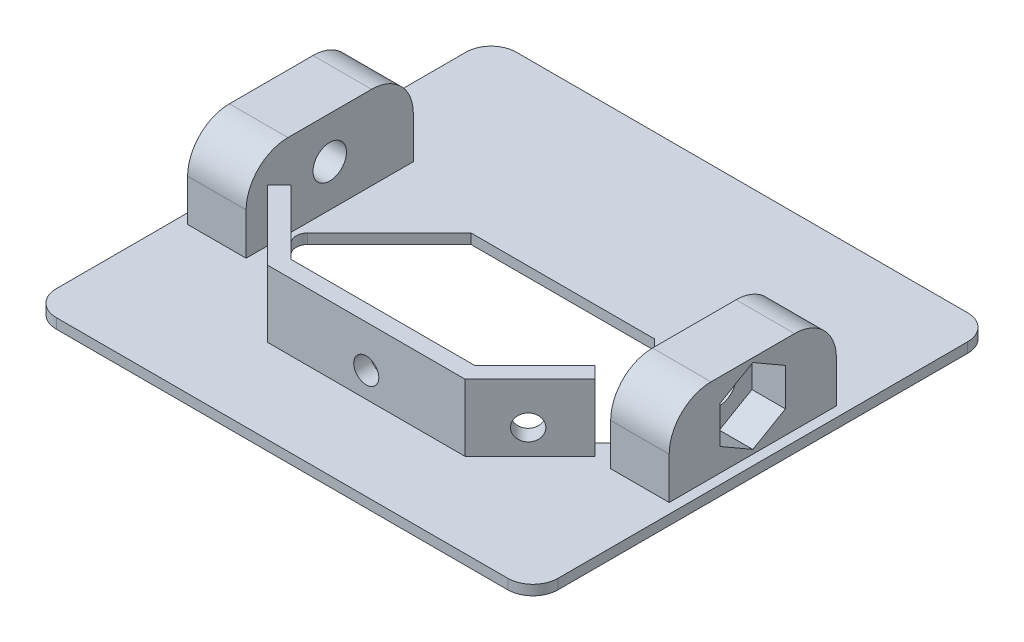
from build123d import *

# Parameters (mm, degrees)
ESBO_O1_W                = 60
ESBO_O1_H                = 55
RESSALTO_EXTRUS_O1_DEPTH = 1.2
ESBO_O2_W                = 22
ESBO_O2_H                = 21.5
CORTE_EXTRUS_O1_DEPTH    = 41.714739346
RESSALTO_EXTRUS_O2_DEPTH = 8
ESBO_O4_R                = 1.5
CORTE_EXTRUS_O2_DEPTH    = 7
ESBO_O5_R                = 1.5
CORTE_EXTRUS_O3_DEPTH    = 7
ESBO_O6_R                = 1.5
CORTE_EXTRUS_O4_DEPTH    = 7
FILETE1_R                = 3
FILETE2_R                = 3
FILETE3_R                = 3
FILETE4_R                = 3
ESBO_O8_W                = 7
ESBO_O8_H                = 20
RESSALTO_EXTRUS_O3_DEPTH = 10
CORTE_EXTRUS_O6_DEPTH    = 4
ESBO_O11_R               = 2
CORTE_EXTRUS_O7_DEPTH    = 10
CORTE_EXTRUS_O8_DEPTH    = 4
CORTE_EXTRUS_O9_START    = -10
ESBO_O13_R               = 2
CORTE_EXTRUS_O9_DEPTH    = 10
FILETE5_R                = 5
FILETE6_R                = 5
FILETE7_R                = 5
FILETE9_R                = 5


with BuildPart() as part:
    # Esboço1 → Ressalto-extrusão1 (new body)
    with BuildSketch(Plane(origin=(0, 0, 0), x_dir=(1, 0, 0), z_dir=(0, 1, 0))):
        Rectangle(ESBO_O1_W, ESBO_O1_H)
    extrude(amount=RESSALTO_EXTRUS_O1_DEPTH)

    # Esboço2 → Corte-extrusão1 (cut, through all)
    with BuildSketch(Plane(origin=(0, 1.2, 0), x_dir=(1, 0, 0), z_dir=(0, 1, 0))):
        with Locations((0, -4.680960194)):
            Rectangle(ESBO_O2_W, ESBO_O2_H)
        with BuildLine():
            Line((-20.75, -5.680960194), (-11, -15.430960194))
            Line((-11, -15.430960194), (-11, 6.069039806))
            Line((-11, 6.069039806), (-20.75, -3.680960194))
            ThreePointArc((-20.75, -3.680960194), (-21.131966011, -4.680960194), (-20.75, -5.680960194))
        make_face()
        with BuildLine():
            Line((11, 6.069039806), (11, -15.430960194))
            Line((11, -15.430960194), (20.75, -5.680960194))
            ThreePointArc((20.75, -5.680960194), (21.131966011, -4.680960194), (20.75, -3.680960194))
            Line((20.75, -3.680960194), (11, 6.069039806))
        make_face()
    extrude(amount=-CORTE_EXTRUS_O1_DEPTH, mode=Mode.SUBTRACT)

    # Esboço3 → Ressalto-extrusão2 (add)
    with BuildSketch(Plane(origin=(0, 1.2, 0), x_dir=(1, 0, 0), z_dir=(0, 1, 0))):
        Polygon((-10.998427125, -17.430960194), (10.998427125, -17.430960194), (11.828427125, -17.430960194), (19.606601718, -9.652785601), (18.192388155, -8.238572039), (11, -15.430960194), (-11, -15.430960194), (-18.681875297, -7.749084898), (-20.096088859, -9.16329846), (-11.828427125, -17.430960194), align=None)
    extrude(amount=RESSALTO_EXTRUS_O2_DEPTH)

    # Esboço4 → Corte-extrusão2 (cut)
    with BuildSketch(Plane(origin=(13.215480097, 0, 13.215480097), x_dir=(-0.7071067811865465, 0, 0.7071067811865487), z_dir=(-0.7071067811865487, 0, -0.7071067811865465))):
        with Locations((-1.366837999, 4.2)):
            Circle(ESBO_O4_R)
    extrude(amount=-CORTE_EXTRUS_O2_DEPTH, mode=Mode.SUBTRACT)

    # Esboço5 → Corte-extrusão3 (cut)
    with BuildSketch(Plane(origin=(0, 0, 15.430960194), x_dir=(-1, 0, 0), z_dir=(0, 0, -1))):
        with Locations((0, 4.2)):
            Circle(ESBO_O5_R)
    extrude(amount=-CORTE_EXTRUS_O3_DEPTH, mode=Mode.SUBTRACT)

    # Esboço6 → Corte-extrusão4 (cut)
    with BuildSketch(Plane(origin=(-13.215480097, 0, 13.215480097), x_dir=(-0.7071067811865466, 0, -0.7071067811865485), z_dir=(0.7071067811865485, 0, -0.7071067811865466))):
        with Locations((1.366837999, 4.2)):
            Circle(ESBO_O6_R)
    extrude(amount=-CORTE_EXTRUS_O4_DEPTH, mode=Mode.SUBTRACT)

    # Filete1
    filete1_edges = [part.edges().sort_by_distance(p)[0] for p in [
        (-30, 0.6, -27.5),
    ]]
    fillet(filete1_edges, radius=FILETE1_R)

    # Filete2
    filete2_edges = [part.edges().sort_by_distance(p)[0] for p in [
        (30, 0.6, -27.5),
    ]]
    fillet(filete2_edges, radius=FILETE2_R)

    # Filete3
    filete3_edges = [part.edges().sort_by_distance(p)[0] for p in [
        (30, 0.6, 27.5),
    ]]
    fillet(filete3_edges, radius=FILETE3_R)

    # Filete4
    filete4_edges = [part.edges().sort_by_distance(p)[0] for p in [
        (-30, 0.6, 27.5),
    ]]
    fillet(filete4_edges, radius=FILETE4_R)

    # Esboço8 → Ressalto-extrusão3 (add)
    with BuildSketch(Plane(origin=(0, 1.2, 0), x_dir=(1, 0, 0), z_dir=(0, 1, 0))):
        with Locations((-25.3, 0)):
            Rectangle(ESBO_O8_W, ESBO_O8_H)
        with Locations((25.3, 0)):
            Rectangle(ESBO_O8_W, ESBO_O8_H)
    extrude(amount=RESSALTO_EXTRUS_O3_DEPTH)

    # Esboço9 → Corte-extrusão6 (cut)
    with BuildSketch(Plane.ZY.offset(28.8)):
        Polygon((0, 1.7), (3.897114317, 3.95), (3.897114317, 8.45), (0, 10.7), (-3.897114317, 8.45), (-3.897114317, 3.95), align=None)
    extrude(amount=-CORTE_EXTRUS_O6_DEPTH, mode=Mode.SUBTRACT)

    # Esboço11 → Corte-extrusão7 (cut)
    with BuildSketch(Plane.ZY.offset(24.8)):
        with Locations((0, 6.2)):
            Circle(ESBO_O11_R)
    extrude(amount=-CORTE_EXTRUS_O7_DEPTH, mode=Mode.SUBTRACT)

    # Esboço12 → Corte-extrusão8 (cut)
    with BuildSketch(Plane(origin=(28.8, 0, 0), x_dir=(0, 0, -1), z_dir=(1, 0, 0))):
        Polygon((0, 1.7), (3.897114317, 3.95), (3.897114317, 8.45), (0, 10.7), (-3.897114317, 8.45), (-3.897114317, 3.95), align=None)
    extrude(amount=-CORTE_EXTRUS_O8_DEPTH, mode=Mode.SUBTRACT)

    # Esboço13 → Corte-extrusão9 (cut)
    with BuildSketch(Plane(origin=(24.8, 0, 0), x_dir=(0, 0, -1), z_dir=(1, 0, 0)).offset(CORTE_EXTRUS_O9_START)):
        with Locations(Location((0, 6.2, 0), (0, 0, 180))):
            Circle(ESBO_O13_R)
    extrude(amount=CORTE_EXTRUS_O9_DEPTH, mode=Mode.SUBTRACT)

    # Filete5
    filete5_edges = [part.edges().sort_by_distance(p)[0] for p in [
        (25.3, 11.2, 10),
    ]]
    fillet(filete5_edges, radius=FILETE5_R)

    # Filete6
    filete6_edges = [part.edges().sort_by_distance(p)[0] for p in [
        (25.3, 11.2, -10),
    ]]
    fillet(filete6_edges, radius=FILETE6_R)

    # Filete7
    filete7_edges = [part.edges().sort_by_distance(p)[0] for p in [
        (-25.3, 11.2, -10),
    ]]
    fillet(filete7_edges, radius=FILETE7_R)

    # Filete9
    filete9_edges = [part.edges().sort_by_distance(p)[0] for p in [
        (-25.3, 11.2, 10),
    ]]
    fillet(filete9_edges, radius=FILETE9_R)


solid = part.part
